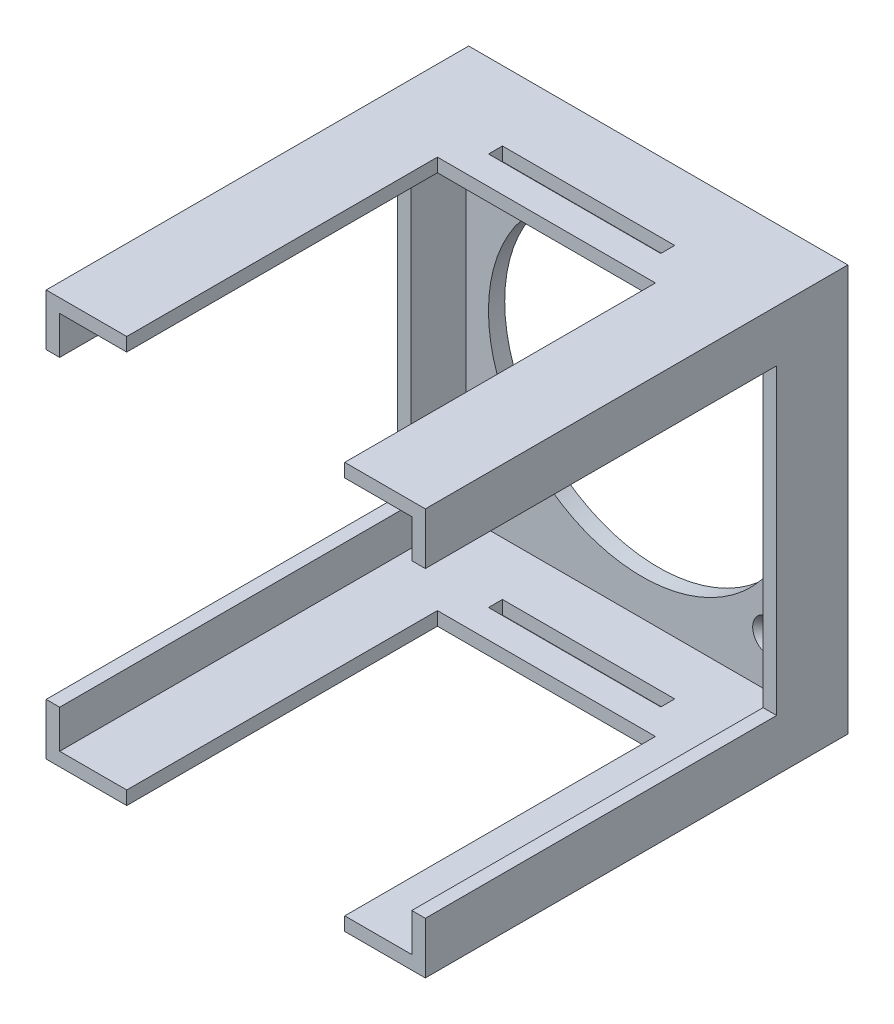
from build123d import *

# Parameters (mm, degrees)
ESBO_O1_W                                    = 140
ESBO_O1_H                                    = 150
RESSALTO_EXTRUS_O1_DEPTH                     = 6
ESBO_O2_W                                    = 140
ESBO_O2_H                                    = 150
ESBO_O2_W_2                                  = 130
ESBO_O2_H_2                                  = 140
RESSALTO_EXTRUS_O2_DEPTH                     = 150
ESBO_O3_W                                    = 80.487326646
ESBO_O3_H                                    = 259.40979835
CORTE_EXTRUS_O1_DEPTH                        = 150
ESBO_O4_W                                    = 259.40979835
ESBO_O4_H                                    = 111.824801178
CORTE_EXTRUS_O2_DEPTH                        = 150
ESCAREADO_PARA_PARAFUSO_COM_CABE_A_E_2_COUNT = 2
ESCAREADO_PARA_PARAFUSO_COM_CABE_A_E_2_PITCH = 94.314867898
ESCAREADO_PARA_PARAFUSO_COM_CABE_A_E_3_COUNT = 2
ESCAREADO_PARA_PARAFUSO_COM_CABE_A_E_3_PITCH = 104.661646655
ESCAREADO_PARA_PARAFUSO_COM_CABE_A_E_4_COUNT = 2
ESCAREADO_PARA_PARAFUSO_COM_CABE_A_E_4_PITCH = 140.887737533
ESBO_O11_W                                   = 80.487326646
ESBO_O11_H                                   = 5
RESSALTO_EXTRUS_O5_DEPTH                     = 15
ESBO_O12_W                                   = 63.61017092
ESBO_O12_H                                   = 5.135500038
CORTE_EXTRUS_O3_DEPTH                        = 219
ESBO_O13_R                                   = 56.69336486
CORTE_EXTRUS_O4_DEPTH                        = 10


with BuildPart() as part:
    # Esboço1 → Ressalto-extrusão1 (new body)
    with BuildSketch(Plane.XY):
        with Locations((70, 75)):
            Rectangle(ESBO_O1_W, ESBO_O1_H)
    extrude(amount=RESSALTO_EXTRUS_O1_DEPTH)

    # Esboço2 → Ressalto-extrusão2 (add)
    with BuildSketch(Plane.XY.offset(6)):
        with Locations((70, 75)):
            Rectangle(ESBO_O2_W, ESBO_O2_H)
        with Locations((70, 75)):
            Rectangle(ESBO_O2_W_2, ESBO_O2_H_2, mode=Mode.SUBTRACT)
    extrude(amount=RESSALTO_EXTRUS_O2_DEPTH)

    # Esboço3 → Corte-extrusão1 (cut)
    with BuildSketch(Plane.XZ):
        with Locations((70, 156)):
            Rectangle(ESBO_O3_W, ESBO_O3_H)
    extrude(amount=-CORTE_EXTRUS_O1_DEPTH, mode=Mode.SUBTRACT)

    # Esboço4 → Corte-extrusão2 (cut)
    with BuildSketch(Plane.ZY):
        with Locations((156, 75)):
            Rectangle(ESBO_O4_W, ESBO_O4_H)
    extrude(amount=-CORTE_EXTRUS_O2_DEPTH, mode=Mode.SUBTRACT)

    # Esboço6 → Escareado para parafuso com cabeça escareada elevada de M61 (revolve, cut)
    with BuildSketch(Plane(origin=(22.842566051, 127.330823328, 6), x_dir=(0, -1, 0), z_dir=(1, 0, 0))):
        Polygon((0, 0), (0, 6), (3.5, 6), (3.5, 2.8), (6.3, 0), align=None)
    escareado_para_parafuso_com_cabe_a_escar = revolve(axis=Axis((22.842566051, 127.330823328, 12.35), (0, 0, -1)), mode=Mode.SUBTRACT)

    # Escareado para parafuso com cabe_a e 2: Escareado para parafuso com cabeça escareada elevada de M61 ×2
    with Locations(*[(i * ESCAREADO_PARA_PARAFUSO_COM_CABE_A_E_2_PITCH, 0, 0) for i in range(1, ESCAREADO_PARA_PARAFUSO_COM_CABE_A_E_2_COUNT)]):
        add(escareado_para_parafuso_com_cabe_a_escar, mode=Mode.SUBTRACT)

    # Escareado para parafuso com cabe_a e 3: Escareado para parafuso com cabeça escareada elevada de M61 ×2
    with Locations(*[(0, -i * ESCAREADO_PARA_PARAFUSO_COM_CABE_A_E_3_PITCH, 0) for i in range(1, ESCAREADO_PARA_PARAFUSO_COM_CABE_A_E_3_COUNT)]):
        add(escareado_para_parafuso_com_cabe_a_escar, mode=Mode.SUBTRACT)

    # Escareado para parafuso com cabe_a e 4: Escareado para parafuso com cabeça escareada elevada de M61 ×2
    with Locations(*[Vector(0.6694327664681964, -0.7428726480216763, 0) * (i * ESCAREADO_PARA_PARAFUSO_COM_CABE_A_E_4_PITCH) for i in range(1, ESCAREADO_PARA_PARAFUSO_COM_CABE_A_E_4_COUNT)]):
        add(escareado_para_parafuso_com_cabe_a_escar, mode=Mode.SUBTRACT)

    # Esboço11 → Ressalto-extrusão5 (add)
    with BuildSketch(Plane.XY.offset(26.295100825)):
        with Locations((70, 147.5)):
            Rectangle(ESBO_O11_W, ESBO_O11_H)
        with Locations((70, 2.5)):
            Rectangle(ESBO_O11_W, ESBO_O11_H)
    extrude(amount=RESSALTO_EXTRUS_O5_DEPTH)

    # Esboço12 → Corte-extrusão3 (cut)
    with BuildSketch(Plane.XZ):
        with Locations((70, 28.296802645)):
            Rectangle(ESBO_O12_W, ESBO_O12_H)
    extrude(amount=-CORTE_EXTRUS_O3_DEPTH, mode=Mode.SUBTRACT)

    # Esboço13 → Corte-extrusão4 (cut)
    with BuildSketch(Plane.XY.offset(6)):
        with Locations((70, 75)):
            Circle(ESBO_O13_R)
    extrude(amount=-CORTE_EXTRUS_O4_DEPTH, mode=Mode.SUBTRACT)


solid = part.part
